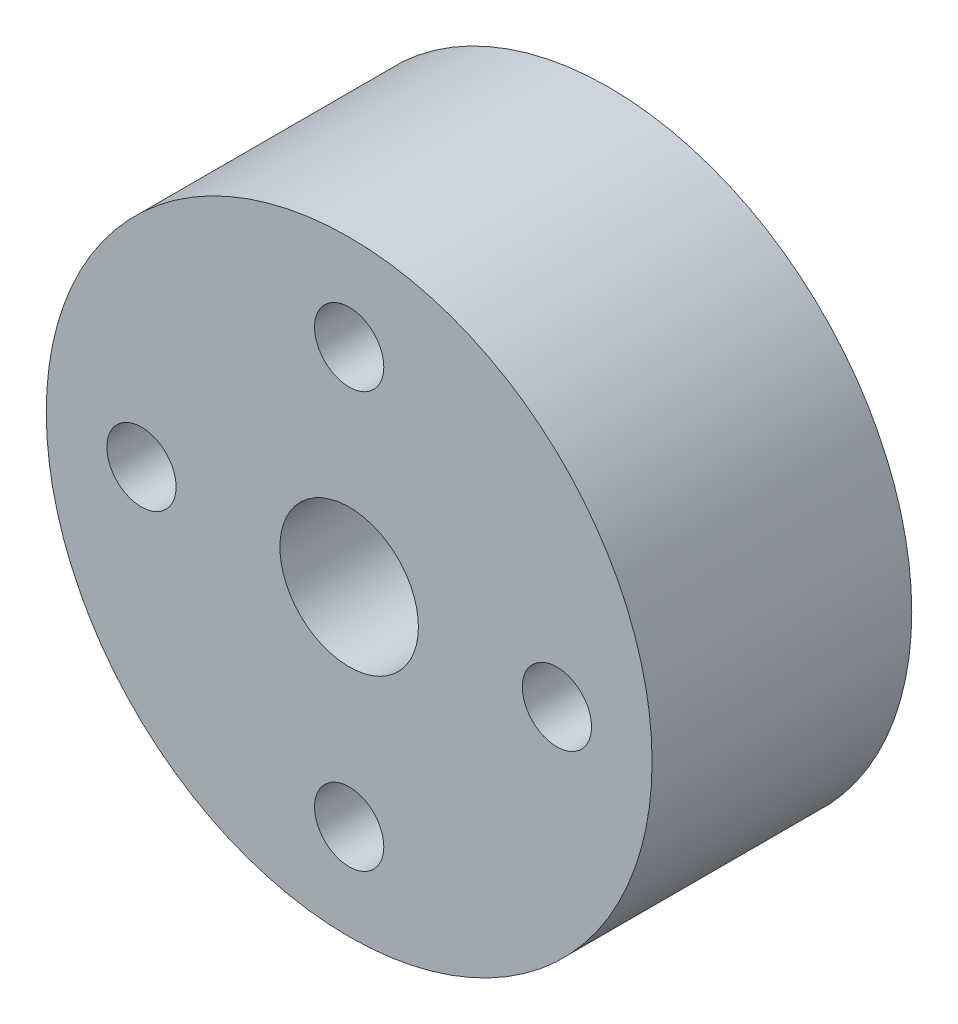
from build123d import *

# Parameters (mm, degrees)
SKETCH1_R           = 17.5
SKETCH1_R_2         = 4
SKETCH1_R_3         = 2
BOSS_EXTRUDE1_DEPTH = 15


with BuildPart() as part:
    # Sketch1 → Boss-Extrude1 (new body)
    with BuildSketch(Plane.XY):
        Circle(SKETCH1_R)
        Circle(SKETCH1_R_2, mode=Mode.SUBTRACT)
        with Locations((12, 0)):
            Circle(SKETCH1_R_3, mode=Mode.SUBTRACT)
        with Locations((0, -12)):
            Circle(SKETCH1_R_3, mode=Mode.SUBTRACT)
        with Locations((-12, 0)):
            Circle(SKETCH1_R_3, mode=Mode.SUBTRACT)
        with Locations((0, 12)):
            Circle(SKETCH1_R_3, mode=Mode.SUBTRACT)
    extrude(amount=BOSS_EXTRUDE1_DEPTH)


solid = part.part
